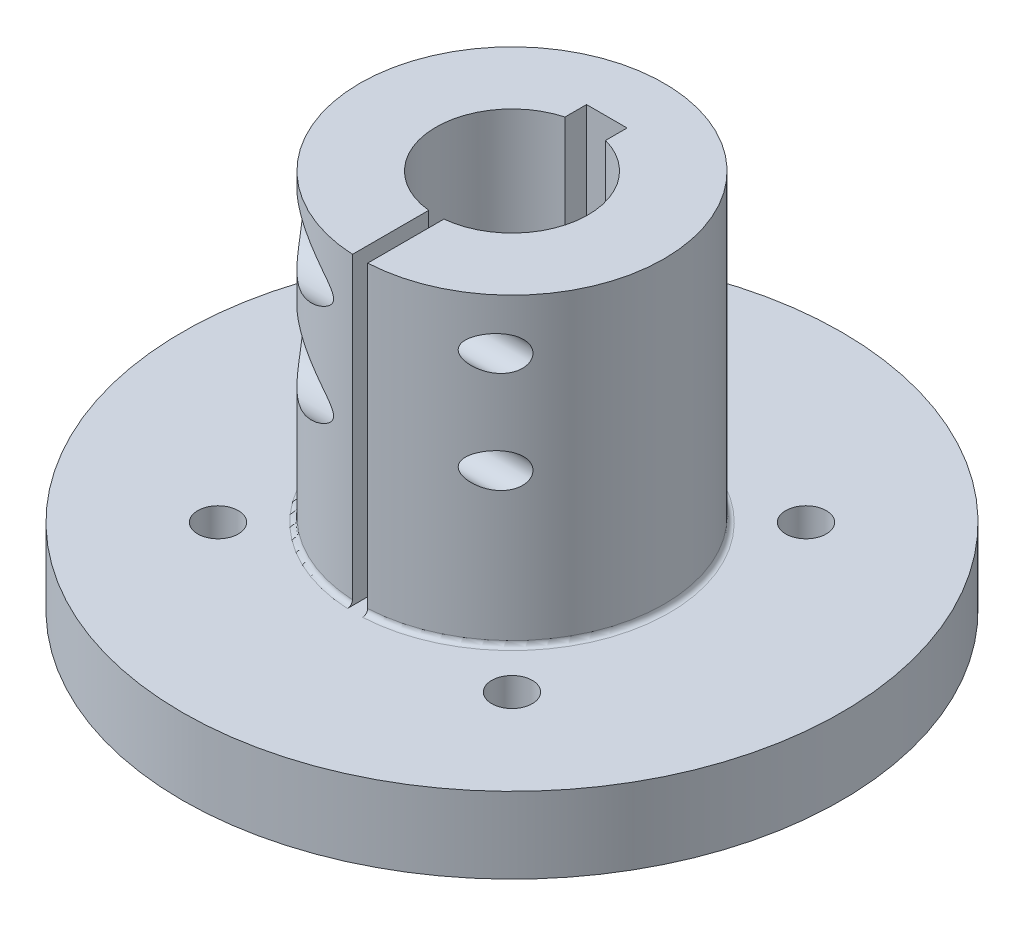
from build123d import *

# Parameters (mm, degrees)
SKETCH3_R           = 4
BOSS_EXTRUDE1_DEPTH = 15
BOSS_EXTRUDE2_DEPTH = 60
SKETCH6_R           = 3.4
CUT_EXTRUDE1_DEPTH  = 107.024394791
SKETCH7_R           = 4
CUT_EXTRUDE2_DEPTH  = 107.024394862
CUT_EXTRUDE3_START  = -5
SKETCH10_R          = 7
SKETCH10_R_2        = 3.4
CUT_EXTRUDE3_DEPTH  = 102.024394862
BOSS_EXTRUDE3_DEPTH = 15
FILLET1_R           = 1


with BuildPart() as part:
    # Sketch3 → Boss-Extrude1 (new body)
    with BuildSketch(Plane(origin=(0, 0, 0), x_dir=(1, 0, 0), z_dir=(0, 1, 0))):
        with BuildLine():
            ThreePointArc((-50.387748924, -18.119611268), (-46.048367083, 0), (-50.387748924, 18.119611268))
            ThreePointArc((-50.387748924, 18.119611268), (-45.961940777, 45.961940777), (-18.119611268, 50.387748924))
            ThreePointArc((-18.119611268, 50.387748924), (0, 46.048367083), (18.119611268, 50.387748924))
            ThreePointArc((18.119611268, 50.387748924), (45.961940777, 45.961940777), (50.387748924, 18.119611268))
            ThreePointArc((50.387748924, 18.119611268), (46.048367083, 0), (50.387748924, -18.119611268))
            ThreePointArc((50.387748924, -18.119611268), (45.961940777, -45.961940777), (18.119611268, -50.387748924))
            ThreePointArc((18.119611268, -50.387748924), (0, -46.048367083), (-18.119611268, -50.387748924))
            ThreePointArc((-18.119611268, -50.387748924), (-45.961940777, -45.961940777), (-50.387748924, -18.119611268))
        make_face()
        with Locations(Location((28.991378029, 28.991378029, 0), (0, 0, 270))):
            Circle(SKETCH3_R, mode=Mode.SUBTRACT)
        with Locations(Location((28.991378029, -28.991378029, 0), (0, 0, 270))):
            Circle(SKETCH3_R, mode=Mode.SUBTRACT)
        with Locations(Location((-28.991378029, -28.991378029, 0), (0, 0, 270))):
            Circle(SKETCH3_R, mode=Mode.SUBTRACT)
        with Locations(Location((-28.991378029, 28.991378029, 0), (0, 0, 270))):
            Circle(SKETCH3_R, mode=Mode.SUBTRACT)
        with BuildLine():
            Line((-4, 18.7), (-4, 14.456832295))
            ThreePointArc((-4, 14.456832295), (0, -15), (4, 14.456832295))
            Line((4, 14.456832295), (4, 18.7))
            Line((4, 18.7), (-4, 18.7))
        make_face(mode=Mode.SUBTRACT)
    extrude(amount=BOSS_EXTRUDE1_DEPTH)

    # Sketch4 → Boss-Extrude2 (add)
    with BuildSketch(Plane(origin=(0, 15, 0), x_dir=(1, 0, 0), z_dir=(0, 1, 0))):
        with BuildLine():
            Line((-4, 14.456832295), (-4, 18.7))
            Line((-4, 18.7), (4, 18.7))
            Line((4, 18.7), (4, 14.456832295))
            ThreePointArc((4, 14.456832295), (14.945994408, -1.271711896), (1.5, -14.924811557))
            Line((1.5, -14.924811557), (1.5, -29.962476533))
            ThreePointArc((1.5, -29.962476533), (21.737065119, -20.676073128), (30, 0))
            ThreePointArc((30, 0), (-20.676073128, 21.737065119), (-1.5, -29.962476533))
            Line((-1.5, -29.962476533), (-1.5, -14.924811557))
            ThreePointArc((-1.5, -14.924811557), (-14.945994408, -1.271711896), (-4, 14.456832295))
        make_face()
    extrude(amount=BOSS_EXTRUDE2_DEPTH)

    # Sketch6 → Cut-Extrude1 (cut, through all)
    with BuildSketch(Plane(origin=(0, 0, 0), x_dir=(0, 0, -1), z_dir=(1, 0, 0))):
        with Locations(Location((-22.443644045, 65, 0), (0, 0, 180))):
            Circle(SKETCH6_R)
        with Locations(Location((-22.443644045, 45, 0), (0, 0, 180))):
            Circle(SKETCH6_R)
    extrude(amount=CUT_EXTRUDE1_DEPTH, mode=Mode.SUBTRACT)

    # Sketch7 → Cut-Extrude2 (cut, through all)
    with BuildSketch(Plane(origin=(0, 0, 0), x_dir=(0, 0, -1), z_dir=(1, 0, 0))):
        with Locations((-22.443644045, 65)):
            Circle(SKETCH7_R)
        with Locations((-22.443644045, 45)):
            Circle(SKETCH7_R)
    extrude(amount=-CUT_EXTRUDE2_DEPTH, mode=Mode.SUBTRACT)

    # Sketch10 → Cut-Extrude3 (cut, through all)
    # profile 1 of 2: a face of its own
    with BuildSketch(Plane(origin=(0, 0, 0), x_dir=(0, 0, -1), z_dir=(1, 0, 0)).offset(CUT_EXTRUDE3_START)):
        with Locations((-22.443644045, 65)):
            Circle(SKETCH10_R)
        with Locations(Location((-22.443644045, 65, 0), (0, 0, 180))):
            Circle(SKETCH10_R_2, mode=Mode.SUBTRACT)
    # profile 2 of 2: a face of its own
    with BuildSketch(Plane(origin=(0, 0, 0), x_dir=(0, 0, -1), z_dir=(1, 0, 0)).offset(CUT_EXTRUDE3_START)):
        with Locations((-22.443644045, 45)):
            Circle(SKETCH10_R)
        with Locations(Location((-22.443644045, 45, 0), (0, 0, 180))):
            Circle(SKETCH10_R_2, mode=Mode.SUBTRACT)
    extrude(amount=-CUT_EXTRUDE3_DEPTH, mode=Mode.SUBTRACT)

    # Sketch11 → Boss-Extrude3 (add)
    with BuildSketch(Plane(origin=(0, 0, 0), x_dir=(1, 0, 0), z_dir=(0, 1, 0))):
        with BuildLine():
            ThreePointArc((-50.387748924, 18.119611268), (-52.693787753, 32.759105894), (-45.961940644, 45.96194091))
            ThreePointArc((-45.961940644, 45.96194091), (-65, 1.62e-07), (-45.961940873, -45.961940681))
            ThreePointArc((-45.961940873, -45.961940681), (-52.693787778, -32.759105733), (-50.387748924, -18.119611268))
            ThreePointArc((-50.387748924, -18.119611268), (-46.048367083, 0), (-50.387748924, 18.119611268))
        make_face()
        with BuildLine():
            ThreePointArc((18.119611268, 50.387748924), (32.759105845, 52.693787761), (45.961940841, 45.961940713))
            ThreePointArc((45.961940841, 45.961940713), (1.4e-07, 65), (-45.961940644, 45.96194091))
            ThreePointArc((-45.961940644, 45.96194091), (-32.759105708, 52.693787782), (-18.119611268, 50.387748924))
            ThreePointArc((-18.119611268, 50.387748924), (0, 46.048367083), (18.119611268, 50.387748924))
        make_face()
        with BuildLine():
            ThreePointArc((-45.961940873, -45.961940681), (-8.4e-08, -65), (45.961940754, -45.9619408))
            ThreePointArc((45.961940754, -45.9619408), (32.759105785, -52.69378777), (18.119611268, -50.387748924))
            ThreePointArc((18.119611268, -50.387748924), (0, -46.048367083), (-18.119611268, -50.387748924))
            ThreePointArc((-18.119611268, -50.387748924), (-32.759105868, -52.693787757), (-45.961940873, -45.961940681))
        make_face()
        with BuildLine():
            ThreePointArc((45.961940754, -45.9619408), (60.052169607, -24.874423119), (65, 0))
            ThreePointArc((65, 0), (60.052169631, 24.874423062), (45.961940841, 45.961940713))
            ThreePointArc((45.961940841, 45.961940713), (52.693787775, 32.759105756), (50.387748924, 18.119611268))
            ThreePointArc((50.387748924, 18.119611268), (46.048367083, 0), (50.387748924, -18.119611268))
            ThreePointArc((50.387748924, -18.119611268), (52.693787765, -32.759105817), (45.961940754, -45.9619408))
        make_face()
    extrude(amount=BOSS_EXTRUDE3_DEPTH)

    # Fillet1
    fillet1_edges = [part.edges().sort_by_distance(p)[0] for p in [
        (0, 15, -30),
    ]]
    fillet(fillet1_edges, radius=FILLET1_R)


solid = part.part
